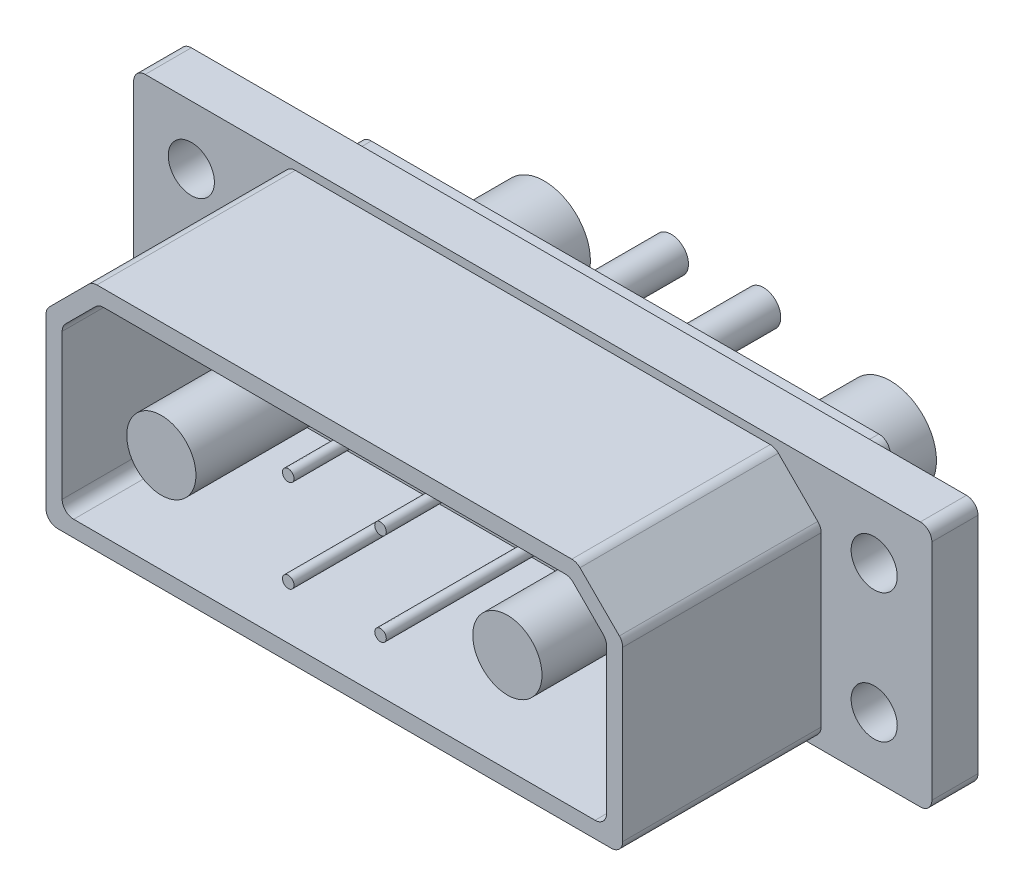
from build123d import *

# Parameters (mm, degrees)
SKETCH_1_W          = 34.6
SKETCH_1_H          = 10.7
EXTRUDE_1_DEPTH     = 2
SKETCH_2_R          = 1
CUT_EXTRUDE_1_DEPTH = 2
EXTRUDE_2_DEPTH     = 8.6
CUT_EXTRUDE_2_DEPTH = 8.5
SKETCH_5_R          = 1.5
SKETCH_5_R_2        = 0.25
EXTRUDE_3_DEPTH     = 8.5
SKETCH_6_W          = 23
SKETCH_6_H          = 7.5
EXTRUDE_4_DEPTH     = 2
SKETCH_7_R          = 2
SKETCH_7_R_2        = 0.75
EXTRUDE_5_DEPTH     = 4
FILLET_2_R          = 0.5


with BuildPart() as part:
    # 草图1 → 凸台-拉伸1 (new body)
    with BuildSketch(Plane.XY):
        Rectangle(SKETCH_1_W, SKETCH_1_H)
    extrude(amount=EXTRUDE_1_DEPTH)

    # 草图2 → 切除-拉伸1 (cut)
    with BuildSketch(Plane.XY.offset(2)):
        with Locations((-14.8, 2.8)):
            Circle(SKETCH_2_R)
        with Locations(Location((14.8, 2.8, 0), (0, 0, 180))):
            Circle(SKETCH_2_R)
        with Locations((14.8, -2.8)):
            Circle(SKETCH_2_R)
        with Locations(Location((-14.8, -2.8, 0), (0, 0, 180))):
            Circle(SKETCH_2_R)
    extrude(amount=-CUT_EXTRUDE_1_DEPTH, mode=Mode.SUBTRACT)

    # 草图3 → 凸台-拉伸2 (add)
    with BuildSketch(Plane.XY.offset(2)):
        Polygon((10.5, 5), (-10.5, 5), (-12.5, 3), (-12.5, -5), (12.5, -5), (12.5, 3), align=None)
    extrude(amount=EXTRUDE_2_DEPTH)

    # 草图4 → 切除-拉伸2 (cut)
    with BuildSketch(Plane.XY.offset(10.6)):
        Polygon((-10.210050506, 4.3), (-11.8, 2.710050506), (-11.8, -4.3), (11.8, -4.3), (11.8, 2.710050506), (10.210050506, 4.3), align=None)
    extrude(amount=-CUT_EXTRUDE_2_DEPTH, mode=Mode.SUBTRACT)

    # 草图5 → 凸台-拉伸3 (add)
    with BuildSketch(Plane.XY.offset(2.1)):
        with Locations((-7.5, 0)):
            Circle(SKETCH_5_R)
        with Locations((-2, 2)):
            Circle(SKETCH_5_R_2)
        with Locations(Location((2, 2, 0), (0, 0, 180))):
            Circle(SKETCH_5_R_2)
        with Locations(Location((7.5, 0, 0), (0, 0, 180))):
            Circle(SKETCH_5_R)
        with Locations((2, -2)):
            Circle(SKETCH_5_R_2)
        with Locations(Location((-2, -2, 0), (0, 0, 180))):
            Circle(SKETCH_5_R_2)
    extrude(amount=EXTRUDE_3_DEPTH)

    # 草图6 → 凸台-拉伸4 (add)
    with BuildSketch(Plane(origin=(0, 0, 0), x_dir=(-1, 0, 0), z_dir=(0, 0, -1))):
        Rectangle(SKETCH_6_W, SKETCH_6_H)
    extrude(amount=EXTRUDE_4_DEPTH)

    # 草图7 → 凸台-拉伸5 (add)
    with BuildSketch(Plane(origin=(0, 0, -2), x_dir=(-1, 0, 0), z_dir=(0, 0, -1))):
        with Locations(Location((-7.5, 0, 0), (0, 0, 180))):
            Circle(SKETCH_7_R)
        with Locations(Location((-2, 2, 0), (0, 0, 180))):
            Circle(SKETCH_7_R_2)
        with Locations(Location((2, 2, 0), (0, 0, 180))):
            Circle(SKETCH_7_R_2)
        with Locations(Location((7.5, 0, 0), (0, 0, 180))):
            Circle(SKETCH_7_R)
        with Locations(Location((2, -2, 0), (0, 0, 180))):
            Circle(SKETCH_7_R_2)
        with Locations(Location((-2, -2, 0), (0, 0, 180))):
            Circle(SKETCH_7_R_2)
    extrude(amount=EXTRUDE_5_DEPTH)

    # 圆角2
    fillet_2_edges = [part.edges().sort_by_distance(p)[0] for p in [
        (-10.5, 5, 6.3),
        (-12.5, 3, 6.3),
        (-12.5, -5, 6.3),
        (12.5, -5, 6.3),
        (12.5, 3, 6.3),
        (10.5, 5, 6.3),
        (-10.210050506, 4.3, 6.35),
        (10.210050506, 4.3, 6.35),
        (11.8, 2.710050506, 6.35),
        (11.8, -4.3, 6.35),
        (-11.8, -4.3, 6.35),
        (-11.8, 2.710050506, 6.35),
        (17.3, -5.35, 1),
        (-17.3, -5.35, 1),
        (-17.3, 5.35, 1),
        (17.3, 5.35, 1),
        (-11.5, -3.75, -1),
        (-11.5, 3.75, -1),
        (11.5, 3.75, -1),
        (11.5, -3.75, -1),
    ]]
    fillet(fillet_2_edges, radius=FILLET_2_R)


solid = part.part
